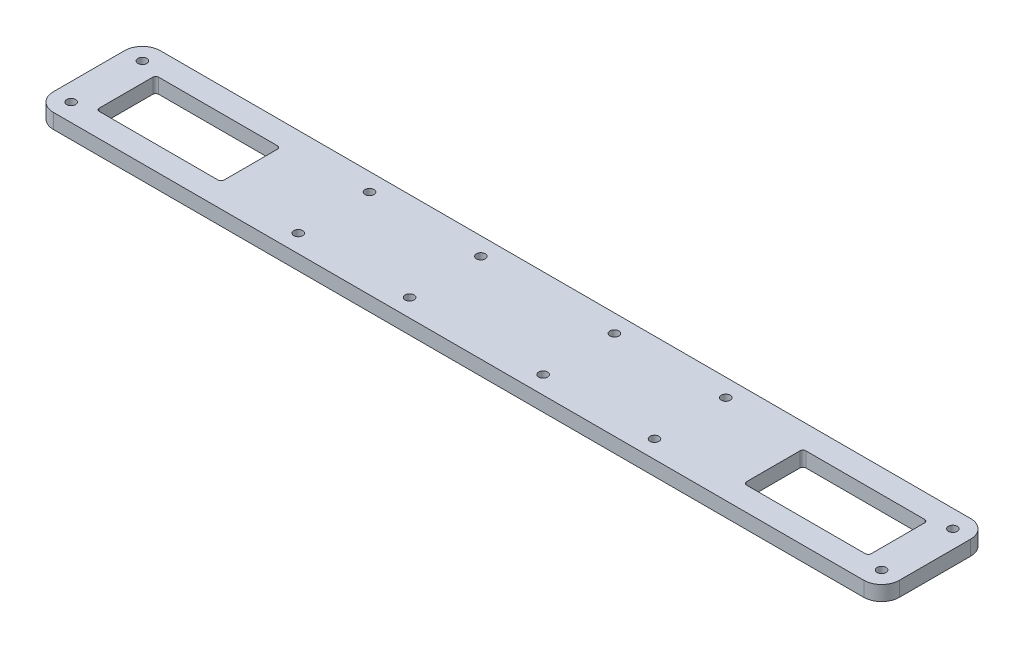
from build123d import *

# Parameters (mm, degrees)
SKETCH1_W           = 285
SKETCH1_H           = 36
SKETCH1_R           = 1.5
SKETCH1_W_2         = 42
SKETCH1_H_2         = 20
BOSS_EXTRUDE2_DEPTH = 5
FILLET1_R           = 6
FILLET2_R           = 1


with BuildPart() as part:
    # Sketch1 → Boss-Extrude2 (new body)
    with BuildSketch(Plane(origin=(0, 0, 0), x_dir=(1, 0, 0), z_dir=(0, 1, 0))):
        Rectangle(SKETCH1_W, SKETCH1_H)
        with Locations(Location((-22.5, -12, 0), (0, 0, 270))):
            Circle(SKETCH1_R, mode=Mode.SUBTRACT)
        with Locations(Location((-22.5, 12, 0), (0, 0, 90))):
            Circle(SKETCH1_R, mode=Mode.SUBTRACT)
        with Locations(Location((-136.5, -12, 0), (0, 0, 270))):
            Circle(SKETCH1_R, mode=Mode.SUBTRACT)
        with Locations(Location((-136.5, 12, 0), (0, 0, 90))):
            Circle(SKETCH1_R, mode=Mode.SUBTRACT)
        with Locations(Location((22.5, -12, 0), (0, 0, 90))):
            Circle(SKETCH1_R, mode=Mode.SUBTRACT)
        with Locations(Location((22.5, 12, 0), (0, 0, 270))):
            Circle(SKETCH1_R, mode=Mode.SUBTRACT)
        with Locations(Location((136.5, -12, 0), (0, 0, 90))):
            Circle(SKETCH1_R, mode=Mode.SUBTRACT)
        with Locations(Location((136.5, 12, 0), (0, 0, 270))):
            Circle(SKETCH1_R, mode=Mode.SUBTRACT)
        with Locations(Location((-60, 12, 0), (0, 0, 270))):
            Circle(SKETCH1_R, mode=Mode.SUBTRACT)
        with Locations(Location((-60, -12, 0), (0, 0, 90))):
            Circle(SKETCH1_R, mode=Mode.SUBTRACT)
        with Locations(Location((60, -12, 0), (0, 0, 270))):
            Circle(SKETCH1_R, mode=Mode.SUBTRACT)
        with Locations(Location((60, 12, 0), (0, 0, 90))):
            Circle(SKETCH1_R, mode=Mode.SUBTRACT)
        with Locations((-109, 0)):
            Rectangle(SKETCH1_W_2, SKETCH1_H_2, mode=Mode.SUBTRACT)
        with Locations((109, 0)):
            Rectangle(SKETCH1_W_2, SKETCH1_H_2, mode=Mode.SUBTRACT)
    extrude(amount=BOSS_EXTRUDE2_DEPTH)

    # Fillet1
    fillet1_edges = [part.edges().sort_by_distance(p)[0] for p in [
        (142.5, 2.5, 18),
        (-142.5, 2.5, 18),
        (-142.5, 2.5, -18),
        (142.5, 2.5, -18),
    ]]
    fillet(fillet1_edges, radius=FILLET1_R)

    # Fillet2
    fillet2_edges = [part.edges().sort_by_distance(p)[0] for p in [
        (-88, 2.5, 10),
        (-88, 2.5, -10),
        (-130, 2.5, -10),
        (-130, 2.5, 10),
        (88, 2.5, -10),
        (88, 2.5, 10),
        (130, 2.5, 10),
        (130, 2.5, -10),
    ]]
    fillet(fillet2_edges, radius=FILLET2_R)


solid = part.part
